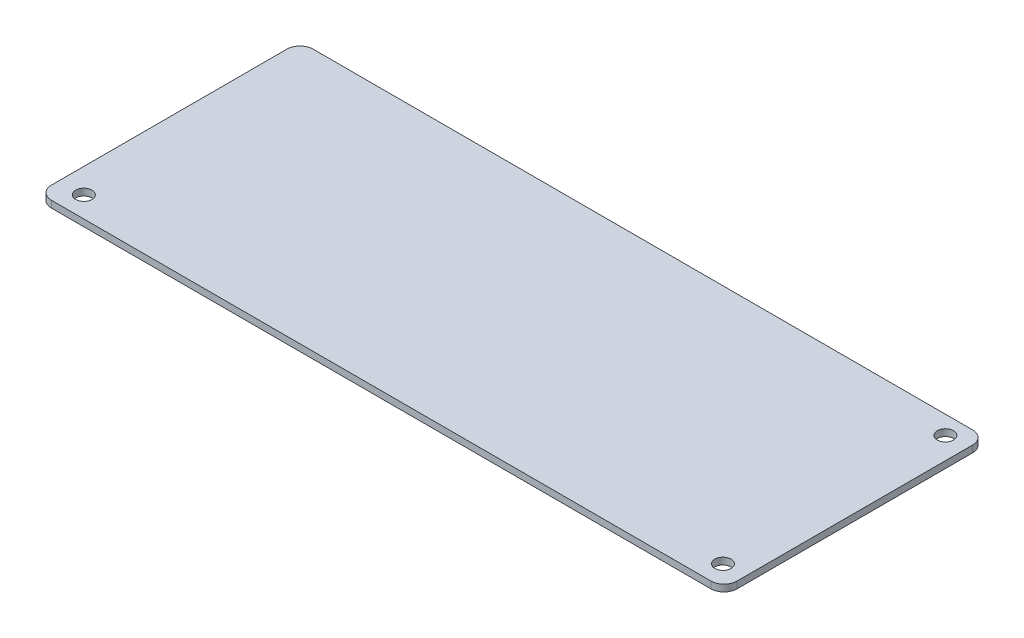
from build123d import *

# Parameters (mm, degrees)
BOSS_EXTRUDE1_DEPTH = 1.3
SKETCH2_R           = 1.55
CUT_EXTRUDE1_DEPTH  = 5.3


with BuildPart() as part:
    # Sketch1 → Boss-Extrude1 (new body)
    with BuildSketch(Plane(origin=(0, 0, 0), x_dir=(1, 0, 0), z_dir=(0, 1, 0))):
        with BuildLine():
            Line((63, -25), (-63, -25))
            ThreePointArc((-63, -25), (-64.767766953, -24.267766953), (-65.5, -22.5))
            Line((-65.5, -22.5), (-65.5, 22.5))
            ThreePointArc((-65.5, 22.5), (-64.767766953, 24.267766953), (-63, 25))
            Line((-63, 25), (63, 25))
            ThreePointArc((63, 25), (64.767766953, 24.267766953), (65.5, 22.5))
            Line((65.5, 22.5), (65.5, -22.5))
            ThreePointArc((65.5, -22.5), (64.767766953, -24.267766953), (63, -25))
        make_face()
    extrude(amount=BOSS_EXTRUDE1_DEPTH)

    # Sketch2 → Cut-Extrude1 (cut)
    with BuildSketch(Plane(origin=(0, 1.3, 0), x_dir=(1, 0, 0), z_dir=(0, 1, 0))):
        with Locations(Location((-60.8, -21, 0), (0, 0, 270))):
            Circle(SKETCH2_R)
        with Locations(Location((61.3, 21.5, 0), (0, 0, 270))):
            Circle(SKETCH2_R)
        with Locations(Location((61.3, -21, 0), (0, 0, 270))):
            Circle(SKETCH2_R)
    extrude(amount=-CUT_EXTRUDE1_DEPTH, mode=Mode.SUBTRACT)


solid = part.part
